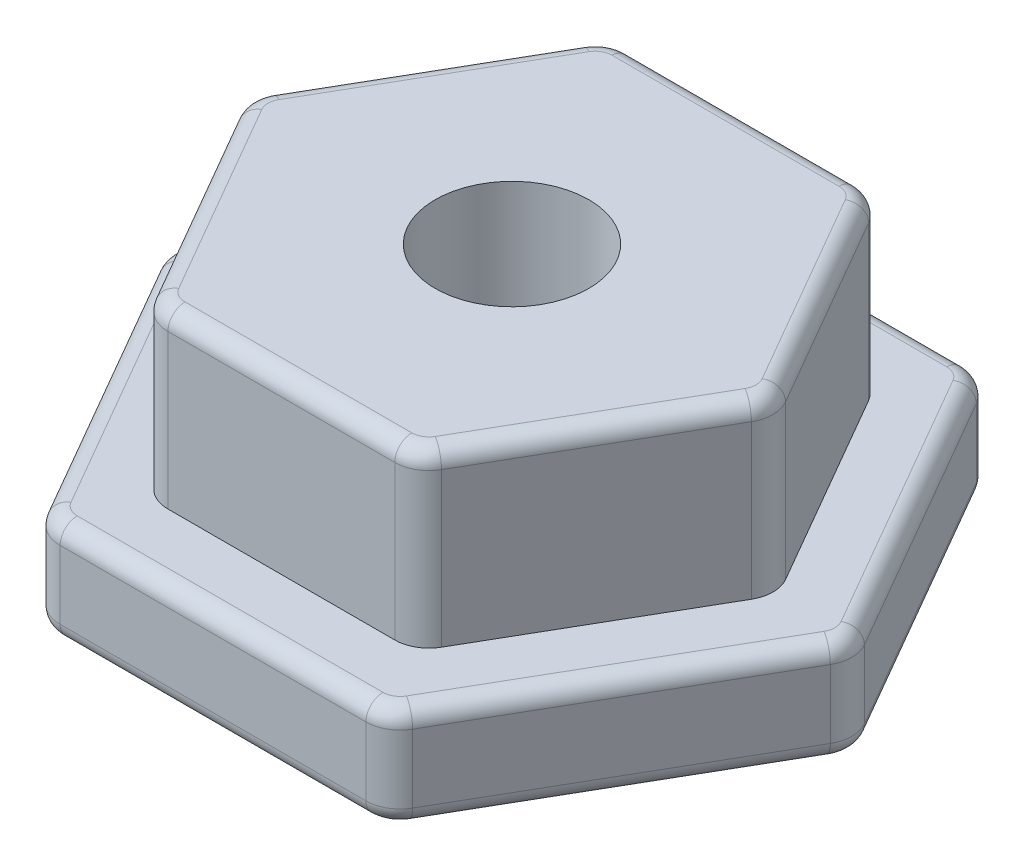
from build123d import *

# Parameters (mm, degrees)
BOSS_EXTRUDE1_DEPTH                      = 3
BOSS_EXTRUDE2_DEPTH                      = 5
CBORE_FOR_M4_PAN_HEAD_SCREW1_D           = 4.5
CBORE_FOR_M4_PAN_HEAD_SCREW1_CBORE_D     = 9
CBORE_FOR_M4_PAN_HEAD_SCREW1_CBORE_DEPTH = 3.1
FILLET1_R                                = 1
FILLET2_R                                = 1
FILLET5_R                                = 0.5
FILLET6_R                                = 0.5
FILLET7_R                                = 0.5


with BuildPart() as part:
    # Sketch1 → Boss-Extrude1 (new body)
    with BuildSketch(Plane(origin=(0, 0, 0), x_dir=(1, 0, 0), z_dir=(0, 1, 0))):
        Polygon((10.103629711, 0), (5.051814855, 8.75), (-5.051814855, 8.75), (-10.103629711, 0), (-5.051814855, -8.75), (5.051814855, -8.75), align=None)
    extrude(amount=BOSS_EXTRUDE1_DEPTH)

    # Sketch2 → Boss-Extrude2 (add)
    with BuildSketch(Plane(origin=(0, 3, 0), x_dir=(1, 0, 0), z_dir=(0, 1, 0))):
        Polygon((3.897114317, -6.75), (7.794228634, 0), (3.897114317, 6.75), (-3.897114317, 6.75), (-7.794228634, 0), (-3.897114317, -6.75), align=None)
    extrude(amount=BOSS_EXTRUDE2_DEPTH)

    # CBORE for M4 Pan Head Screw1 (through all)
    with Locations(Plane.XZ):
        with Locations((0, 0)):
            CounterBoreHole(CBORE_FOR_M4_PAN_HEAD_SCREW1_D / 2, CBORE_FOR_M4_PAN_HEAD_SCREW1_CBORE_D / 2, CBORE_FOR_M4_PAN_HEAD_SCREW1_CBORE_DEPTH)

    # Fillet1
    fillet1_edges = [part.edges().sort_by_distance(p)[0] for p in [
        (-3.897114317, 5.5, 6.75),
        (3.897114317, 5.5, 6.75),
        (7.794228634, 5.5, 0),
        (3.897114317, 5.5, -6.75),
        (-3.897114317, 5.5, -6.75),
        (-7.794228634, 5.5, 0),
    ]]
    fillet(fillet1_edges, radius=FILLET1_R)

    # Fillet2
    fillet2_edges = [part.edges().sort_by_distance(p)[0] for p in [
        (5.051814855, 1.5, 8.75),
        (-5.051814855, 1.5, 8.75),
        (-10.103629711, 1.5, 0),
        (-5.051814855, 1.5, -8.75),
        (5.051814855, 1.5, -8.75),
        (10.103629711, 1.5, 0),
    ]]
    fillet(fillet2_edges, radius=FILLET2_R)

    # Fillet5
    fillet5_edges = [part.edges().sort_by_distance(p)[0] for p in [
        (5.845671476, 8, -3.375),
        (5.845671476, 8, 3.375),
        (0, 8, 6.75),
        (0, 8, -6.75),
        (-5.845671476, 8, -3.375),
        (-5.845671476, 8, 3.375),
        (3.819764048, 8, -6.616025404),
        (-3.819764048, 8, -6.616025404),
        (-7.639528096, 8, 0),
        (-3.819764048, 8, 6.616025404),
        (3.819764048, 8, 6.616025404),
        (7.639528096, 8, 0),
    ]]
    fillet(fillet5_edges, radius=FILLET5_R)

    # Fillet6
    fillet6_edges = [part.edges().sort_by_distance(p)[0] for p in [
        (-4.5, 0, 0),
        (-7.577722283, 0, 4.375),
        (7.577722283, 0, 4.375),
        (0, 0, 8.75),
        (-7.577722283, 0, -4.375),
        (0, 0, -8.75),
        (7.577722283, 0, -4.375),
        (-4.974464586, 0, 8.616025404),
        (4.974464586, 0, 8.616025404),
        (9.948929172, 0, 0),
        (4.974464586, 0, -8.616025404),
        (-4.974464586, 0, -8.616025404),
        (-9.948929172, 0, 0),
    ]]
    fillet(fillet6_edges, radius=FILLET6_R)

    # Fillet7
    fillet7_edges = [part.edges().sort_by_distance(p)[0] for p in [
        (-4.974464586, 3, 8.616025404),
        (4.974464586, 3, 8.616025404),
        (9.948929172, 3, 0),
        (4.974464586, 3, -8.616025404),
        (-4.974464586, 3, -8.616025404),
        (-9.948929172, 3, 0),
        (-7.577722283, 3, 4.375),
        (-7.577722283, 3, -4.375),
        (7.577722283, 3, 4.375),
        (7.577722283, 3, -4.375),
        (0, 3, -8.75),
        (0, 3, 8.75),
    ]]
    fillet(fillet7_edges, radius=FILLET7_R)


solid = part.part
